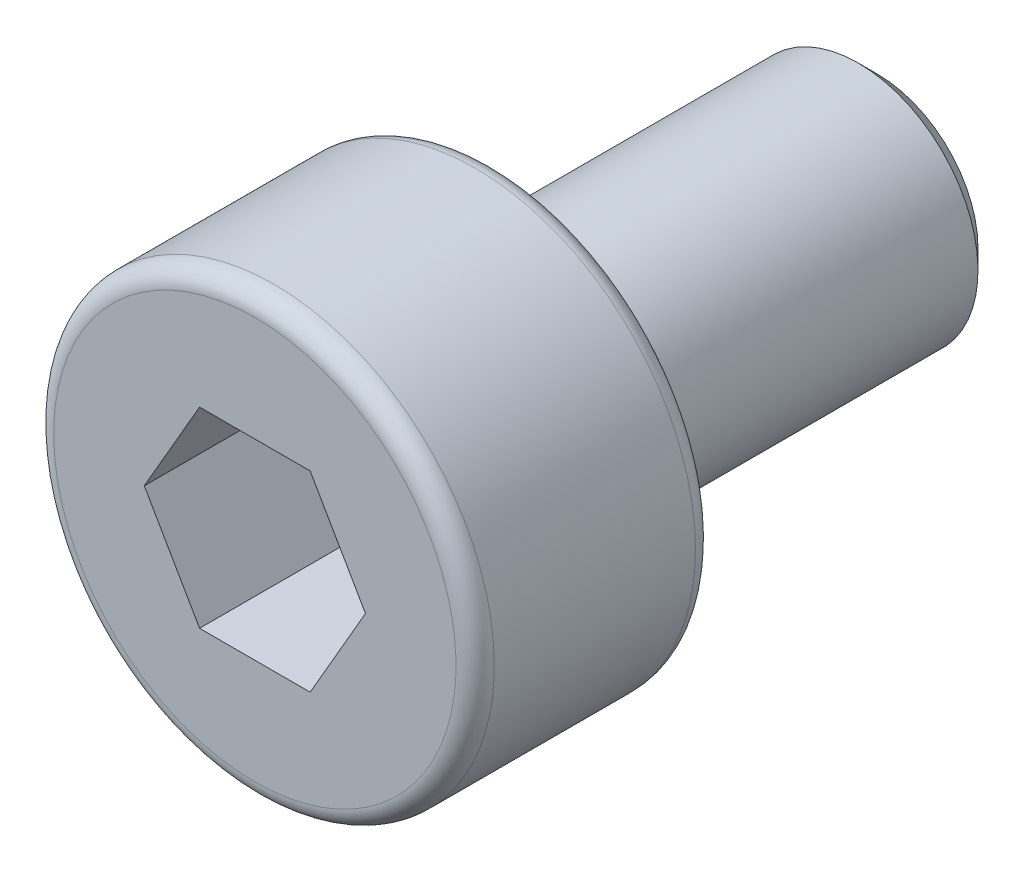
from build123d import *

# Parameters (mm, degrees)
FILLET_1_R          = 0.2
CHAMFER_1_SIZE      = 0.2
CUT_EXTRUDE_1_DEPTH = 1.5


with BuildPart() as part:
    # 草图2 → 旋转1 (revolve)
    with BuildSketch(Plane(origin=(0, 0, 0), x_dir=(0, 0, -1), z_dir=(1, 0, 0))):
        Polygon((0, 0), (0, 2.3), (2.5, 2.3), (2.5, 1.25), (6.5, 1.25), (6.5, 0), align=None)
    revolve(axis=Axis((0, 0, -6.5), (0, 0, 1)))

    # 圆角1
    fillet_1_edges = [part.edges().sort_by_distance(p)[0] for p in [
        (0, -2.3, -2.5),
        (0, -2.3, 0),
    ]]
    fillet(fillet_1_edges, radius=FILLET_1_R)

    # 倒角1
    chamfer_1_edges = [part.edges().sort_by_distance(p)[0] for p in [
        (0, -1.25, -6.5),
    ]]
    chamfer(chamfer_1_edges, length=CHAMFER_1_SIZE)

    # 草图3 → 切除-拉伸1 (cut)
    with BuildSketch(Plane.XY):
        Polygon((1.154700538, 0), (0.577350269, 1), (-0.577350269, 1), (-1.154700538, 0), (-0.577350269, -1), (0.577350269, -1), align=None)
    extrude(amount=-CUT_EXTRUDE_1_DEPTH, mode=Mode.SUBTRACT)


solid = part.part
